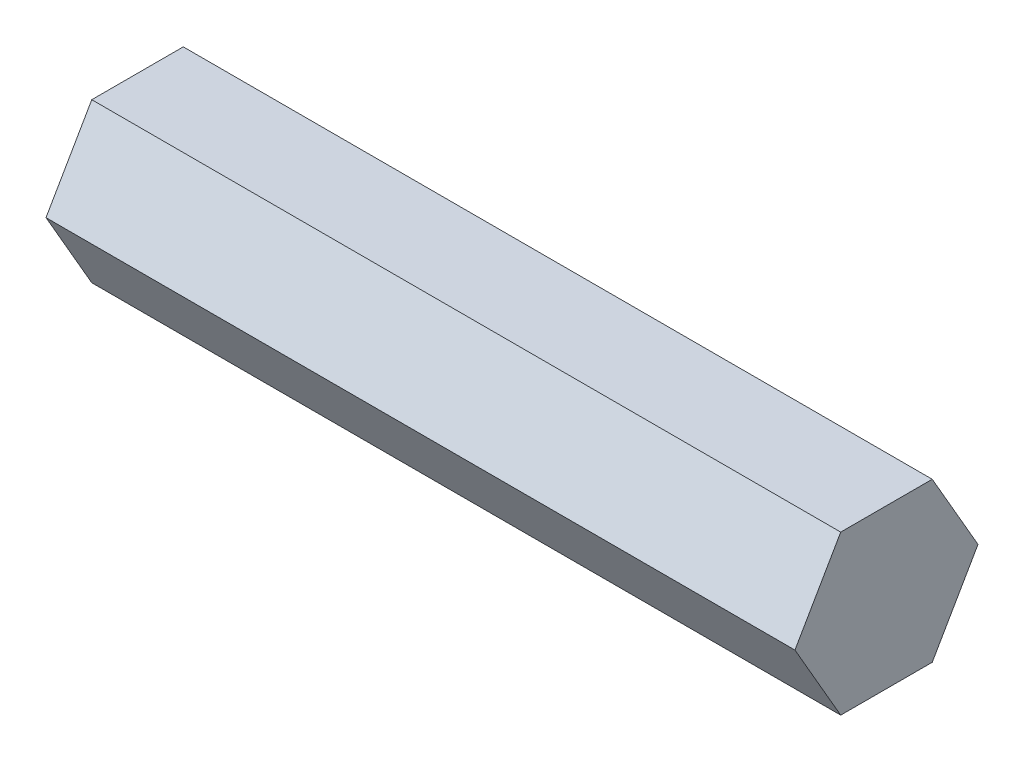
from build123d import *

# Parameters (mm, degrees)
SALIENTE_EXTRUIR1_DEPTH = 60


with BuildPart() as part:
    # Croquis1 → Saliente-Extruir1 (new body)
    with BuildSketch(Plane(origin=(0, 0, 0), x_dir=(0, 0, -1), z_dir=(1, 0, 0))):
        Polygon((7.332348419, 0), (3.666174209, 6.35), (-3.666174209, 6.35), (-7.332348419, 0), (-3.666174209, -6.35), (3.666174209, -6.35), align=None)
    extrude(amount=SALIENTE_EXTRUIR1_DEPTH)


solid = part.part
